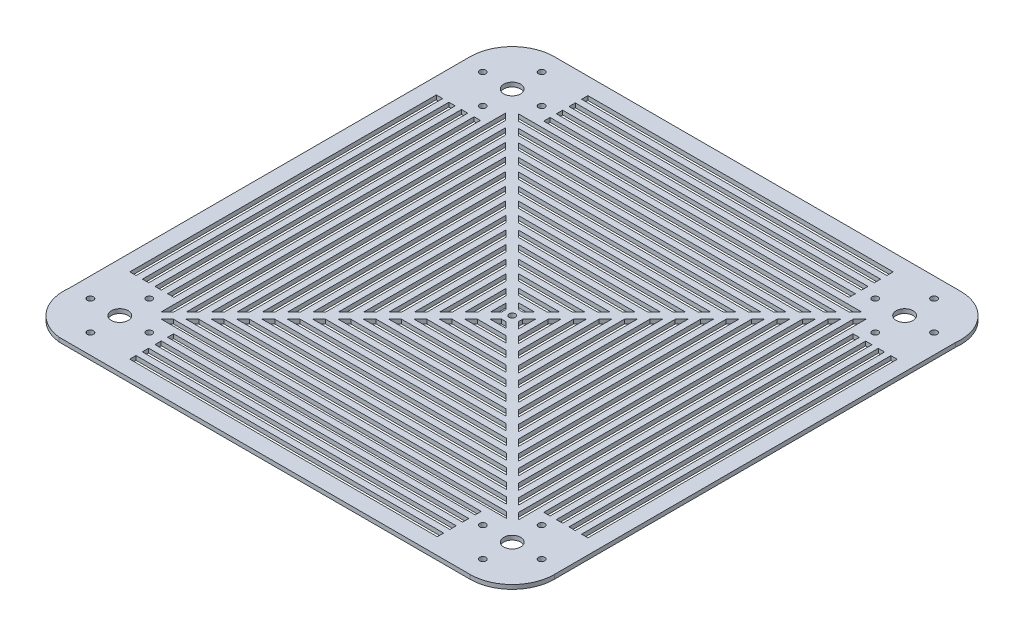
from build123d import *

# Parameters (mm, degrees)
SKETCH_5_R      = 2.25
SKETCH_5_R_2    = 6.02
SKETCH_5_W      = 217.835317333
SKETCH_5_H      = 4.5
SKETCH_5_W_2    = 4.5
SKETCH_5_H_2    = 218.670689826
SKETCH_5_W_3    = 219.485083318
SKETCH_5_H_3    = 4.300855588
SKETCH_5_H_4    = 220.685391672
EXTRUDE_1_DEPTH = 3


with BuildPart() as part:
    # 草图5 → 凸台-拉伸1 (new body)
    with BuildSketch(Plane(origin=(0, 0, 0), x_dir=(1, 0, 0), z_dir=(0, 1, 0))):
        with BuildLine():
            Line((-145, 175.000139282), (144.999922622, 175.000139282))
            ThreePointArc((144.999922622, 175.000139282), (167.429032222, 164.92347758), (174.790880658, 141.462717658))
            Line((174.790880658, 141.462717658), (175.000123274, -144.97808516))
            ThreePointArc((175.000123274, -144.97808516), (166.221042914, -166.205546782), (145, -175.000139282))
            Line((145, -175.000139282), (-148.46080939, -175.000139282))
            ThreePointArc((-148.46080939, -175.000139282), (-168.660495762, -163.766062757), (-175.000139282, -141.539035853))
            Line((-175.000139282, -141.539035853), (-175.000139282, 145))
            ThreePointArc((-175.000139282, 145), (-166.213301923, 166.213301923), (-145, 175.000139282))
        make_face()
        with Locations(Location((140, 119, 0), (0, 0, 270))):
            Circle(SKETCH_5_R, mode=Mode.SUBTRACT)
        with Locations(Location((161, 140, 0), (0, 0, 270))):
            Circle(SKETCH_5_R, mode=Mode.SUBTRACT)
        with Locations(Location((140, 161, 0), (0, 0, 270))):
            Circle(SKETCH_5_R, mode=Mode.SUBTRACT)
        with Locations(Location((119, 140, 0), (0, 0, 270))):
            Circle(SKETCH_5_R, mode=Mode.SUBTRACT)
        with Locations(Location((140, 140, 0), (0, 0, 270))):
            Circle(SKETCH_5_R_2, mode=Mode.SUBTRACT)
        with Locations(Location((140, -161, 0), (0, 0, 270))):
            Circle(SKETCH_5_R, mode=Mode.SUBTRACT)
        with Locations(Location((161, -140, 0), (0, 0, 270))):
            Circle(SKETCH_5_R, mode=Mode.SUBTRACT)
        with Locations(Location((140, -119, 0), (0, 0, 270))):
            Circle(SKETCH_5_R, mode=Mode.SUBTRACT)
        with Locations(Location((119, -140, 0), (0, 0, 270))):
            Circle(SKETCH_5_R, mode=Mode.SUBTRACT)
        with Locations(Location((140, -140, 0), (0, 0, 270))):
            Circle(SKETCH_5_R_2, mode=Mode.SUBTRACT)
        with Locations(Location((-140, 119, 0), (0, 0, 270))):
            Circle(SKETCH_5_R, mode=Mode.SUBTRACT)
        with Locations(Location((-119, 140, 0), (0, 0, 270))):
            Circle(SKETCH_5_R, mode=Mode.SUBTRACT)
        with Locations(Location((-140, 161, 0), (0, 0, 270))):
            Circle(SKETCH_5_R, mode=Mode.SUBTRACT)
        with Locations(Location((-161, 140, 0), (0, 0, 270))):
            Circle(SKETCH_5_R, mode=Mode.SUBTRACT)
        with Locations(Location((-140, 140, 0), (0, 0, 270))):
            Circle(SKETCH_5_R_2, mode=Mode.SUBTRACT)
        with Locations(Location((-140, -161, 0), (0, 0, 270))):
            Circle(SKETCH_5_R, mode=Mode.SUBTRACT)
        with Locations(Location((-119, -140, 0), (0, 0, 270))):
            Circle(SKETCH_5_R, mode=Mode.SUBTRACT)
        with Locations(Location((-140, -119, 0), (0, 0, 270))):
            Circle(SKETCH_5_R, mode=Mode.SUBTRACT)
        with Locations(Location((-161, -139.999994927, 0), (0, 0, 270))):
            Circle(SKETCH_5_R, mode=Mode.SUBTRACT)
        with Locations(Location((-140, -140, 0), (0, 0, 270))):
            Circle(SKETCH_5_R_2, mode=Mode.SUBTRACT)
        with Locations(Location((0, 0, 0), (0, 0, 270))):
            Circle(SKETCH_5_R, mode=Mode.SUBTRACT)
        Polygon((1.5, 6), (5.664469481, 10.164499407), (-5.664499407, 10.164499407), (-1.5, 6), align=None, mode=Mode.SUBTRACT)
        Polygon((-6, 1.5), (-6, -1.5), (-9.953164986, -5.453164986), (-9.953164986, 5.44619859), align=None, mode=Mode.SUBTRACT)
        Polygon((-1.5, -6), (1.5, -6), (5.60601985, -10.091530911), (-5.591530911, -10.091530911), align=None, mode=Mode.SUBTRACT)
        Polygon((6, 1.5), (6, -1.5), (10.514550841, -6.014535357), (10.514550841, 6.014550841), align=None, mode=Mode.SUBTRACT)
        Polygon((-10.153645694, 14.653645694), (10.153583509, 14.653645694), (14.642842109, 19.142936554), (-14.642936554, 19.142936554), align=None, mode=Mode.SUBTRACT)
        Polygon((-14.473916256, 9.958983244), (-14.473916256, -9.973916256), (-18.994667525, -14.494667525), (-18.994667525, 14.471767898), align=None, mode=Mode.SUBTRACT)
        Polygon((-10.111517655, -14.611517655), (10.142012782, -14.611517655), (14.678005714, -19.131504399), (-14.631504399, -19.131504399), align=None, mode=Mode.SUBTRACT)
        Polygon((15.055183993, 10.555183993), (15.055183993, -10.555152936), (19.59098847, -15.090941857), (19.59098847, 15.09098847), align=None, mode=Mode.SUBTRACT)
        Polygon((-19.132227415, 23.632227415), (19.132100709, 23.632227415), (23.62135931, 28.121518275), (-23.621518275, 28.121518275), align=None, mode=Mode.SUBTRACT)
        Polygon((-23.515418795, 18.984552553), (-23.515418795, -19.015418795), (-28.036170065, -23.536170065), (-28.036170065, 23.497337207), align=None, mode=Mode.SUBTRACT)
        Polygon((-19.151491143, -23.651491143), (19.213998646, -23.651491143), (23.749991579, -28.171477888), (-23.671477888, -28.171477888), align=None, mode=Mode.SUBTRACT)
        Polygon((24.126792947, 19.626792947), (24.126792947, -19.626730777), (28.662597424, -24.162519698), (28.662597424, 24.162597424), align=None, mode=Mode.SUBTRACT)
        Polygon((-28.110809135, 32.610809135), (28.11061791, 32.610809135), (32.59987651, 37.100099995), (-32.600099995, 37.100099995), align=None, mode=Mode.SUBTRACT)
        Polygon((-32.556921334, 28.010121861), (-32.556921334, -28.056921334), (-37.077672604, -32.577672604), (-37.077672604, 32.522906516), align=None, mode=Mode.SUBTRACT)
        Polygon((-28.191464632, -32.691464632), (28.285984511, -32.691464632), (32.821977443, -37.211451376), (-32.711451376, -37.211451376), align=None, mode=Mode.SUBTRACT)
        Polygon((33.198401901, 28.698401901), (33.198401901, -28.698308618), (37.734206378, -33.234097539), (37.734206378, 33.234206378), align=None, mode=Mode.SUBTRACT)
        Polygon((-37.089390855, 41.589390855), (37.08913511, 41.589390855), (41.57839371, 46.078681716), (-41.578681716, 46.078681716), align=None, mode=Mode.SUBTRACT)
        Polygon((-41.598423874, 37.03569117), (-41.598423874, -37.098423874), (-46.119175143, -41.619175143), (-46.119175143, 41.548475824), align=None, mode=Mode.SUBTRACT)
        Polygon((-37.23143812, -41.73143812), (37.357970375, -41.73143812), (41.893963307, -46.251424865), (-41.751424865, -46.251424865), align=None, mode=Mode.SUBTRACT)
        Polygon((42.270010854, 37.770010854), (42.270010854, -37.769886459), (46.805815331, -42.30567538), (46.805815331, 42.305815331), align=None, mode=Mode.SUBTRACT)
        Polygon((-46.067972576, 50.567972576), (46.067652311, 50.567972576), (50.556910911, 55.057263436), (-50.557263436, 55.057263436), align=None, mode=Mode.SUBTRACT)
        Polygon((-50.639926413, 46.061260478), (-50.639926413, -46.139926413), (-55.160677683, -50.660677683), (-55.160677683, 50.574045133), align=None, mode=Mode.SUBTRACT)
        Polygon((-46.271411609, -50.771411609), (46.42995624, -50.771411609), (50.965949172, -55.291398353), (-50.791398353, -55.291398353), align=None, mode=Mode.SUBTRACT)
        Polygon((51.341619808, 46.841619808), (51.341619808, -46.8414643), (55.877424285, -51.377253221), (55.877424285, 51.377424285), align=None, mode=Mode.SUBTRACT)
        Polygon((-55.046554296, 59.546554296), (55.046169511, 59.546554296), (59.535428111, 64.035845157), (-59.535845157, 64.035845157), align=None, mode=Mode.SUBTRACT)
        Polygon((-59.681428952, 55.086829787), (-59.681428952, -55.181428952), (-64.202180222, -59.702180222), (-64.202180222, 59.599614441), align=None, mode=Mode.SUBTRACT)
        Polygon((-55.311385097, -59.811385097), (55.501942104, -59.811385097), (60.037935036, -64.331371842), (-59.831371842, -64.331371842), align=None, mode=Mode.SUBTRACT)
        Polygon((60.413228762, 55.913228762), (60.413228762, -55.913042141), (64.949033239, -60.448831062), (64.949033239, 60.449033239), align=None, mode=Mode.SUBTRACT)
        Polygon((-64.025136017, 68.525136017), (64.024686711, 68.525136017), (68.513945312, 73.014426877), (-68.514426877, 73.014426877), align=None, mode=Mode.SUBTRACT)
        Polygon((-68.722931492, 64.112399096), (-68.722931492, -64.222931492), (-73.243682761, -68.743682761), (-73.243682761, 68.62518375), align=None, mode=Mode.SUBTRACT)
        Polygon((-64.351358586, -68.851358586), (64.573927968, -68.851358586), (69.109920901, -73.37134533), (-68.87134533, -73.37134533), align=None, mode=Mode.SUBTRACT)
        Polygon((69.484837716, 64.984837716), (69.484837716, -64.984619982), (74.020642193, -69.520408903), (74.020642193, 69.520642193), align=None, mode=Mode.SUBTRACT)
        Polygon((-73.003717737, 77.503717737), (73.003203912, 77.503717737), (77.492462512, 81.993008598), (-77.493008598, 81.993008598), align=None, mode=Mode.SUBTRACT)
        Polygon((-77.764434031, 73.137968404), (-77.764434031, -73.264434031), (-82.285185301, -77.785185301), (-82.285185301, 77.650753058), align=None, mode=Mode.SUBTRACT)
        Polygon((-73.391332074, -77.891332074), (73.645913833, -77.891332074), (78.181906765, -82.411318819), (-77.911318819, -82.411318819), align=None, mode=Mode.SUBTRACT)
        Polygon((78.55644667, 74.05644667), (78.55644667, -74.056197823), (83.092251147, -78.591986743), (83.092251147, 78.592251147), align=None, mode=Mode.SUBTRACT)
        Polygon((-81.982299458, 86.482299458), (81.981721112, 86.482299458), (86.470979713, 90.971590318), (-86.471590318, 90.971590318), align=None, mode=Mode.SUBTRACT)
        Polygon((-86.80593657, 82.163537713), (-86.80593657, -82.30593657), (-91.32668784, -86.82668784), (-91.32668784, 86.676322367), align=None, mode=Mode.SUBTRACT)
        Polygon((-82.431305563, -86.931305563), (82.717899697, -86.931305563), (87.253892629, -91.451292307), (-86.951292307, -91.451292307), align=None, mode=Mode.SUBTRACT)
        Polygon((87.628055624, 83.128055624), (87.628055624, -83.127775664), (92.163860101, -87.663564584), (92.163860101, 87.663860101), align=None, mode=Mode.SUBTRACT)
        Polygon((-90.960881178, 95.460881178), (90.960238313, 95.460881178), (95.449496913, 99.950172039), (-95.450172039, 99.950172039), align=None, mode=Mode.SUBTRACT)
        Polygon((-95.84743911, 91.189107021), (-95.84743911, -91.34743911), (-100.368190379, -95.868190379), (-100.368190379, 95.701891676), align=None, mode=Mode.SUBTRACT)
        Polygon((-91.471279051, -95.971279051), (91.789885562, -95.971279051), (96.325878494, -100.491265796), (-95.991265796, -100.491265796), align=None, mode=Mode.SUBTRACT)
        Polygon((96.699664577, 92.199664577), (96.699664577, -92.199353505), (101.235469054, -96.735142425), (101.235469054, 96.735469054), align=None, mode=Mode.SUBTRACT)
        Polygon((-99.939462899, 104.439462899), (99.938755513, 104.439462899), (104.428014113, 108.928753759), (-104.428753759, 108.928753759), align=None, mode=Mode.SUBTRACT)
        Polygon((-104.888941649, 100.21467633), (-104.888941649, -100.388941649), (-109.409692919, -104.909692919), (-109.409692919, 104.727460984), align=None, mode=Mode.SUBTRACT)
        Polygon((-100.51125254, -105.01125254), (100.861871426, -105.01125254), (105.397864358, -109.531239284), (-105.031239284, -109.531239284), align=None, mode=Mode.SUBTRACT)
        Polygon((105.771273531, 101.271273531), (105.771273531, -101.270931346), (110.307078008, -105.806720266), (110.307078008, 105.807078008), align=None, mode=Mode.SUBTRACT)
        Polygon((-108.918044619, 113.418044619), (108.917272714, 113.418044619), (113.406531314, 117.90733548), (-113.40733548, 117.90733548), align=None, mode=Mode.SUBTRACT)
        Polygon((-113.930444188, 109.240245638), (-113.930444188, -109.430444188), (-118.451195458, -113.951195458), (-118.451195458, 113.753030293), align=None, mode=Mode.SUBTRACT)
        Polygon((-109.551226028, -114.051226028), (109.93385729, -114.051226028), (114.469850223, -118.571212773), (-114.071212773, -118.571212773), align=None, mode=Mode.SUBTRACT)
        Polygon((114.842882485, 110.342882485), (114.842882485, -110.342509187), (119.378686962, -114.878298107), (119.378686962, 114.878686962), align=None, mode=Mode.SUBTRACT)
        Polygon((-117.89662634, 122.39662634), (117.895789914, 122.39662634), (122.385048514, 126.8859172), (-122.3859172, 126.8859172), align=None, mode=Mode.SUBTRACT)
        Polygon((-122.971946728, 118.265814947), (-122.971946728, -118.471946728), (-127.50304075, -123.00304075), (-127.50304075, 122.788924128), align=None, mode=Mode.SUBTRACT)
        Polygon((-118.591199517, -123.091199517), (119.005843155, -123.091199517), (123.340553384, -127.410613825), (-122.910613825, -127.410613825), align=None, mode=Mode.SUBTRACT)
        Polygon((123.914491439, 119.414491439), (123.914491439, -119.414087028), (128.450295916, -123.949875948), (128.450295916, 123.950295916), align=None, mode=Mode.SUBTRACT)
        with Locations((-0.000385952, 133.668044619)):
            Rectangle(SKETCH_5_W, SKETCH_5_H, mode=Mode.SUBTRACT)
        with Locations((-134.180444188, -0.095099275)):
            Rectangle(SKETCH_5_W_2, SKETCH_5_H_2, mode=Mode.SUBTRACT)
        with Locations((0.191315631, -134.2161251)):
            Rectangle(SKETCH_5_W_3, SKETCH_5_H_3, mode=Mode.SUBTRACT)
        with Locations((135.092882485, 0.000186649)):
            Rectangle(SKETCH_5_W_2, SKETCH_5_H_4, mode=Mode.SUBTRACT)
        with Locations((144.092882485, 0.000186649)):
            Rectangle(SKETCH_5_W_2, SKETCH_5_H_4, mode=Mode.SUBTRACT)
        with Locations((-161.180444188, -0.095099275)):
            Rectangle(SKETCH_5_W_2, SKETCH_5_H_2, mode=Mode.SUBTRACT)
        with Locations((0.191315631, -143.116552894)):
            Rectangle(SKETCH_5_W_3, SKETCH_5_H, mode=Mode.SUBTRACT)
        with Locations((-0.000385952, 151.668044619)):
            Rectangle(SKETCH_5_W, SKETCH_5_H, mode=Mode.SUBTRACT)
        with Locations((-152.180444188, -0.095099275)):
            Rectangle(SKETCH_5_W_2, SKETCH_5_H_2, mode=Mode.SUBTRACT)
        with Locations((0.191315631, -152.116552894)):
            Rectangle(SKETCH_5_W_3, SKETCH_5_H, mode=Mode.SUBTRACT)
        with Locations((153.092882485, 0.000186649)):
            Rectangle(SKETCH_5_W_2, SKETCH_5_H_4, mode=Mode.SUBTRACT)
        with Locations((-0.000385952, 160.668044619)):
            Rectangle(SKETCH_5_W, SKETCH_5_H, mode=Mode.SUBTRACT)
        with Locations((0.191315631, -161.116552894)):
            Rectangle(SKETCH_5_W_3, SKETCH_5_H, mode=Mode.SUBTRACT)
        with Locations((162.092882485, 0.000186649)):
            Rectangle(SKETCH_5_W_2, SKETCH_5_H_4, mode=Mode.SUBTRACT)
        with Locations((-143.180444188, -0.095099275)):
            Rectangle(SKETCH_5_W_2, SKETCH_5_H_2, mode=Mode.SUBTRACT)
        with Locations((-0.000385952, 142.668044619)):
            Rectangle(SKETCH_5_W, SKETCH_5_H, mode=Mode.SUBTRACT)
    extrude(amount=EXTRUDE_1_DEPTH)


solid = part.part
